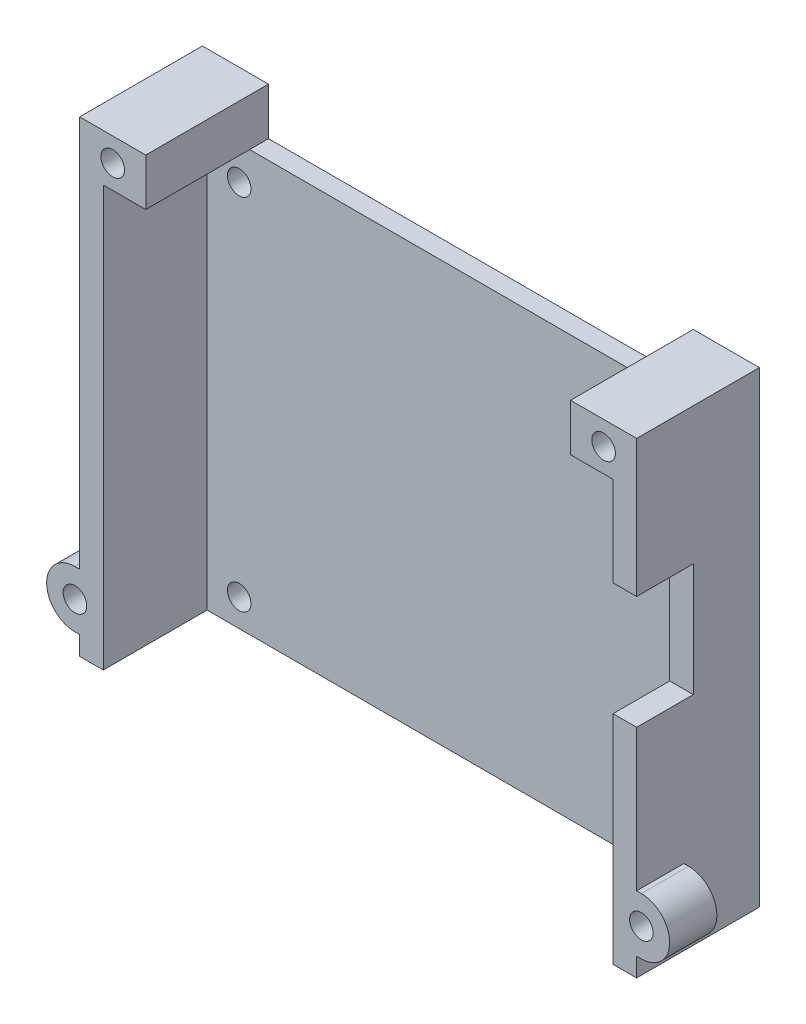
from build123d import *

# Parameters (mm, degrees)
BOSS_EXTRUDE1_DEPTH = 44.5
SKETCH2_W           = 6
SKETCH2_H           = 12
CUT_EXTRUDE1_DEPTH  = 10
BOSS_EXTRUDE2_DEPTH = 13
CUT_EXTRUDE2_DEPTH  = 13
SKETCH4_W           = 7
SKETCH4_H           = 13
BOSS_EXTRUDE3_DEPTH = 5
SKETCH5_R           = 1.25
CUT_EXTRUDE3_DEPTH  = 81.78056697
SKETCH7_R           = 1.25
CUT_EXTRUDE4_DEPTH  = 10
CUT_EXTRUDE6_DEPTH  = 8
BOSS_EXTRUDE4_DEPTH = 7.5


with BuildPart() as part:
    # Sketch1 → Boss-Extrude1 (new body)
    with BuildSketch(Plane(origin=(0, 0, 0), x_dir=(1, 0, 0), z_dir=(0, 1, 0))):
        Polygon((0, 0), (2.5, 0), (2.5, 11), (56.5, 11), (56.5, 0), (59, 0), (59, 13), (0, 13), align=None)
    extrude(amount=BOSS_EXTRUDE1_DEPTH)

    # Sketch2 → Cut-Extrude1 (cut)
    with BuildSketch(Plane(origin=(59, 0, 0), x_dir=(0, 0, -1), z_dir=(1, 0, 0))):
        with Locations((3, 29)):
            Rectangle(SKETCH2_W, SKETCH2_H)
    extrude(amount=-CUT_EXTRUDE1_DEPTH, mode=Mode.SUBTRACT)

    # Sketch3 → Boss-Extrude2 (add)
    with BuildSketch(Plane(origin=(0, 0, -13), x_dir=(-1, 0, 0), z_dir=(0, 0, -1))):
        with BuildLine():
            Line((-59, 6.145643924), (-59, 8))
            Line((-59, 8), (-59.5, 8))
            ThreePointArc((-59.5, 8), (-62.5, 5), (-59.5, 2))
            Line((-59.5, 2), (-59, 2))
            Line((-59, 2), (-59, 3.854356076))
            ThreePointArc((-59, 3.854356076), (-60.75, 5), (-59, 6.145643924))
        make_face()
        with BuildLine():
            Line((0.5, 8), (0, 8))
            Line((0, 8), (0, 6.145643924))
            ThreePointArc((0, 6.145643924), (1.75, 5), (0, 3.854356076))
            Line((0, 3.854356076), (0, 2))
            Line((0, 2), (0.5, 2))
            ThreePointArc((0.5, 2), (3.5, 5), (0.5, 8))
        make_face()
    extrude(amount=-BOSS_EXTRUDE2_DEPTH)

    # Sketch3<3> → Cut-Extrude2 (cut)
    with BuildSketch(Plane(origin=(0, 0, -13), x_dir=(-1, 0, 0), z_dir=(0, 0, -1))):
        with BuildLine():
            ThreePointArc((-59, 3.854356076), (-58.25, 5), (-59, 6.145643924))
            Line((-59, 6.145643924), (-59, 3.854356076))
        make_face()
        with BuildLine():
            Line((0, 3.854356076), (0, 6.145643924))
            ThreePointArc((0, 6.145643924), (-0.75, 5), (0, 3.854356076))
        make_face()
    extrude(amount=-CUT_EXTRUDE2_DEPTH, mode=Mode.SUBTRACT)

    # Sketch4 → Boss-Extrude3 (add)
    with BuildSketch(Plane(origin=(0, 44.5, 0), x_dir=(1, 0, 0), z_dir=(0, 1, 0))):
        with Locations((3.5, 6.5)):
            Rectangle(SKETCH4_W, SKETCH4_H)
        with Locations((55.5, 6.5)):
            Rectangle(SKETCH4_W, SKETCH4_H)
    extrude(amount=BOSS_EXTRUDE3_DEPTH)

    # Sketch5 → Cut-Extrude3 (cut, through all)
    with BuildSketch(Plane(origin=(0, 0, -13), x_dir=(-1, 0, 0), z_dir=(0, 0, -1))):
        with Locations((-55.5, 47)):
            Circle(SKETCH5_R)
        with Locations((-3.5, 47)):
            Circle(SKETCH5_R)
        with Locations((-6, 73.35)):
            Circle(SKETCH5_R)
        with Locations((-53, 73.35)):
            Circle(SKETCH5_R)
    extrude(amount=-CUT_EXTRUDE3_DEPTH, mode=Mode.SUBTRACT)

    # Sketch7 → Cut-Extrude4 (cut)
    with BuildSketch(Plane(origin=(0, 0, -13), x_dir=(-1, 0, 0), z_dir=(0, 0, -1))):
        with Locations((-5.9, 2.9)):
            Circle(SKETCH7_R)
        with Locations((-53.1, 2.9)):
            Circle(SKETCH7_R)
        with Locations((-53.1, 40.95)):
            Circle(SKETCH7_R)
        with Locations((-5.9, 40.95)):
            Circle(SKETCH7_R)
    extrude(amount=-CUT_EXTRUDE4_DEPTH, mode=Mode.SUBTRACT)

    # Sketch3<4> → Cut-Extrude6 (cut)
    with BuildSketch(Plane(origin=(0, 0, -13), x_dir=(-1, 0, 0), z_dir=(0, 0, -1))):
        with BuildLine():
            Line((-59, 6.145643924), (-59, 8))
            Line((-59, 8), (-59.5, 8))
            ThreePointArc((-59.5, 8), (-62.5, 5), (-59.5, 2))
            Line((-59.5, 2), (-59, 2))
            Line((-59, 2), (-59, 3.854356076))
            ThreePointArc((-59, 3.854356076), (-60.75, 5), (-59, 6.145643924))
        make_face()
        with BuildLine():
            Line((0.5, 8), (0, 8))
            Line((0, 8), (0, 6.145643924))
            ThreePointArc((0, 6.145643924), (1.75, 5), (0, 3.854356076))
            Line((0, 3.854356076), (0, 2))
            Line((0, 2), (0.5, 2))
            ThreePointArc((0.5, 2), (3.5, 5), (0.5, 8))
        make_face()
    extrude(amount=-CUT_EXTRUDE6_DEPTH, mode=Mode.SUBTRACT)

    # Sketch3<5> → Boss-Extrude4 (add)
    with BuildSketch(Plane(origin=(0, 0, -13), x_dir=(-1, 0, 0), z_dir=(0, 0, -1))):
        with BuildLine():
            ThreePointArc((-59, 3.854356076), (-58.25, 5), (-59, 6.145643924))
            Line((-59, 6.145643924), (-59, 3.854356076))
        make_face()
        with BuildLine():
            Line((0, 3.854356076), (0, 6.145643924))
            ThreePointArc((0, 6.145643924), (-0.75, 5), (0, 3.854356076))
        make_face()
    extrude(amount=-BOSS_EXTRUDE4_DEPTH)


solid = part.part
